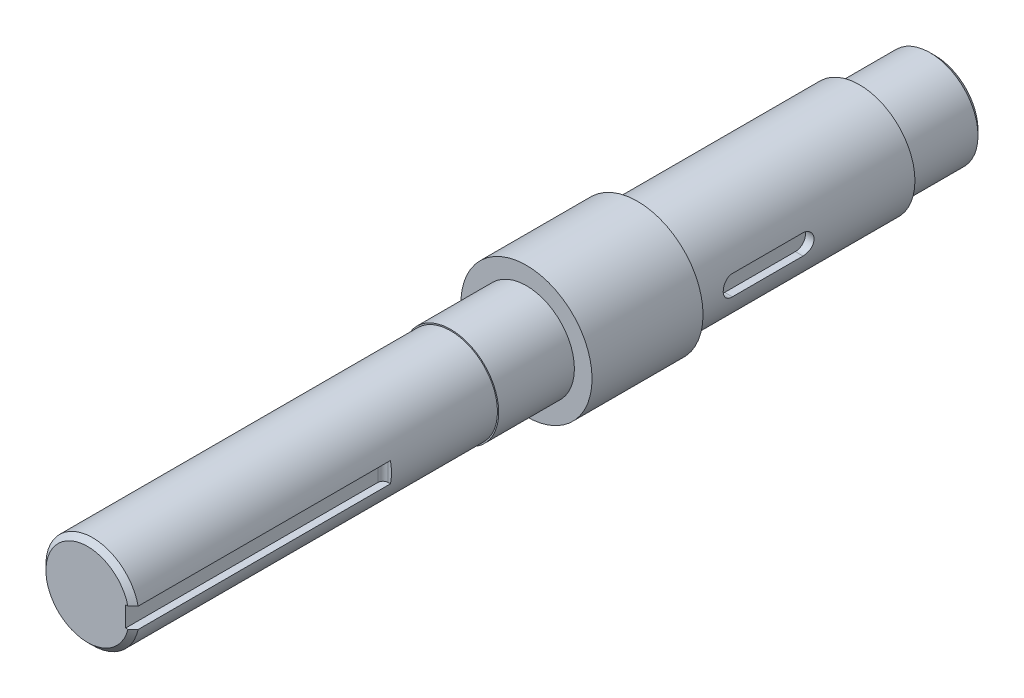
from build123d import *

# Parameters (mm, degrees)
SKETCH3_W          = 4.079746654
SKETCH3_H          = 4
CUT_EXTRUDE1_DEPTH = 51
CUT_EXTRUDE2_START = 11
CUT_EXTRUDE2_DEPTH = 1.7
CHAMFER1_SIZE      = 1
FILLET1_R          = 1


with BuildPart() as part:
    # Sketch2 → Revolve1 (revolve)
    with BuildSketch(Plane(origin=(0, 0, 0), x_dir=(1, 0, 0), z_dir=(0, 1, 0)), mode=Mode.PRIVATE) as revolve1_sk:
        Polygon((0, 0), (-9.25, 0), (-9.25, 72), (-9.5, 72), (-9.5, 87), (-13, 87), (-13, 109), (-11, 109), (-11, 153), (-9.5, 153), (-9.5, 168), (0, 168), align=None)
    revolve(revolve1_sk.sketch.rotate(Axis((0, 0, 0), (0, 0, -1)), 180), axis=Axis((0, 0, 0), (0, 0, -1)))

    # Sketch3 → Cut-Extrude1 (cut)
    with BuildSketch(Plane.XY):
        with Locations((9.589873327, 0)):
            Rectangle(SKETCH3_W, SKETCH3_H)
    extrude(amount=-CUT_EXTRUDE1_DEPTH, mode=Mode.SUBTRACT)

    # Sketch4 → Cut-Extrude2 (cut)
    with BuildSketch(Plane(origin=(0, 0, 0), x_dir=(0, 0, -1), z_dir=(1, 0, 0)).offset(CUT_EXTRUDE2_START)):
        with BuildLine():
            Line((117, 2), (131, 2))
            ThreePointArc((131, 2), (133, 0), (131, -2))
            Line((131, -2), (117, -2))
            ThreePointArc((117, -2), (115, 0), (117, 2))
        make_face()
    extrude(amount=-CUT_EXTRUDE2_DEPTH, mode=Mode.SUBTRACT)

    # Chamfer1
    chamfer1_edges = [part.edges().sort_by_distance(p)[0] for p in [
        (-9.25, 0, 0),
        (-9.5, 0, -168),
    ]]
    chamfer(chamfer1_edges, length=CHAMFER1_SIZE)

    # Fillet1
    fillet1_edges = [part.edges().sort_by_distance(p)[0] for p in [
        (7.55, 0, -51),
    ]]
    fillet(fillet1_edges, radius=FILLET1_R)


solid = part.part
